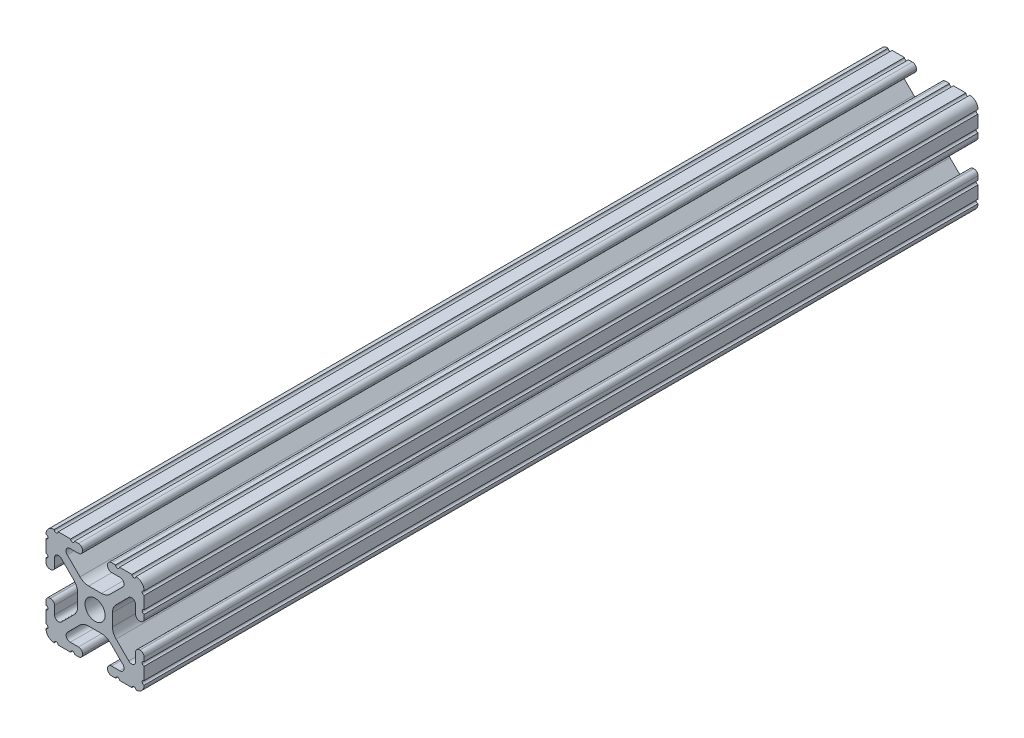
from build123d import *

# Parameters (mm, degrees)
SKETCH1_R           = 2.6035
BOSS_EXTRUDE1_DEPTH = 107.95


with BuildPart() as part:
    # Sketch1 → Boss-Extrude1 (new, symmetric)
    with BuildSketch(Plane.XY):
        with BuildLine():
            Line((-7.179650497, -8.645192506), (-3.952270251, -5.423690499))
            ThreePointArc((-3.952270251, -5.423690499), (-2.922936451, -4.736929036), (-1.709253557, -4.4958))
            Line((-1.709253557, -4.4958), (1.709253557, -4.4958))
            ThreePointArc((1.709253557, -4.4958), (2.922936451, -4.736929036), (3.952270251, -5.423690499))
            Line((3.952270251, -5.423690499), (7.179650497, -8.645192506))
            ThreePointArc((7.179650497, -8.645192506), (7.41473083, -9.822813117), (6.416408329, -10.4902))
            Line((6.416408329, -10.4902), (4.287512407, -10.4902))
            ThreePointArc((4.287512407, -10.4902), (3.54574862, -10.79744862), (3.2385, -11.539212407))
            Line((3.2385, -11.539212407), (3.2385, -11.650987593))
            ThreePointArc((3.2385, -11.650987593), (3.54574862, -12.39275138), (4.287512407, -12.7))
            Line((4.287512407, -12.7), (5.317126718, -12.7))
            ThreePointArc((5.317126718, -12.7), (5.825126718, -12.192), (6.333126718, -12.7))
            Line((6.333126718, -12.7), (9.550443118, -12.7))
            ThreePointArc((9.550443118, -12.7), (10.058366869, -12.192000006), (10.566443095, -12.699847501))
            ThreePointArc((10.566443095, -12.699847501), (12.082537762, -12.08250727), (12.699846982, -10.566399977))
            ThreePointArc((12.699846982, -10.566399977), (12.192000006, -10.058323491), (12.7, -9.5504))
            Line((12.7, -9.5504), (12.7, -6.3330836))
            ThreePointArc((12.7, -6.3330836), (12.192, -5.8250836), (12.7, -5.3170836))
            Line((12.7, -5.3170836), (12.7, -4.287469289))
            ThreePointArc((12.7, -4.287469289), (12.39275138, -3.545705502), (11.650987593, -3.238456882))
            Line((11.650987593, -3.238456882), (11.539212407, -3.238456882))
            ThreePointArc((11.539212407, -3.238456882), (10.79744862, -3.545705502), (10.4902, -4.287469289))
            Line((10.4902, -4.287469289), (10.4902, -6.402089023))
            ThreePointArc((10.4902, -6.402089023), (9.856505071, -7.351067942), (8.737131347, -7.129408934))
            Line((8.737131347, -7.129408934), (5.441005833, -3.840816462))
            ThreePointArc((5.441005833, -3.840816462), (4.750877967, -2.809883091), (4.5085, -1.593185507))
            Line((4.5085, -1.593185507), (4.5085, 1.593185507))
            ThreePointArc((4.5085, 1.593185507), (4.750877967, 2.809883091), (5.441005833, 3.840816462))
            Line((5.441005833, 3.840816462), (8.737131347, 7.129408934))
            ThreePointArc((8.737131347, 7.129408934), (9.856505071, 7.351067942), (10.4902, 6.402089023))
            Line((10.4902, 6.402089023), (10.4902, 4.287469289))
            ThreePointArc((10.4902, 4.287469289), (10.79744862, 3.545705502), (11.539212407, 3.238456882))
            Line((11.539212407, 3.238456882), (11.650987593, 3.238456882))
            ThreePointArc((11.650987593, 3.238456882), (12.39275138, 3.545705502), (12.7, 4.287469289))
            Line((12.7, 4.287469289), (12.7, 5.3170836))
            ThreePointArc((12.7, 5.3170836), (12.192, 5.8250836), (12.7, 6.3330836))
            Line((12.7, 6.3330836), (12.7, 9.5504))
            ThreePointArc((12.7, 9.5504), (12.192000006, 10.058323491), (12.699846982, 10.566399977))
            ThreePointArc((12.699846982, 10.566399977), (12.082537762, 12.08250727), (10.566443095, 12.699847501))
            ThreePointArc((10.566443095, 12.699847501), (10.058366869, 12.192000006), (9.550443118, 12.7))
            Line((9.550443118, 12.7), (6.333126718, 12.7))
            ThreePointArc((6.333126718, 12.7), (5.825126718, 12.192), (5.317126718, 12.7))
            Line((5.317126718, 12.7), (4.287512407, 12.7))
            ThreePointArc((4.287512407, 12.7), (3.54574862, 12.39275138), (3.2385, 11.650987593))
            Line((3.2385, 11.650987593), (3.2385, 11.539212407))
            ThreePointArc((3.2385, 11.539212407), (3.54574862, 10.79744862), (4.287512407, 10.4902))
            Line((4.287512407, 10.4902), (6.476788598, 10.4902))
            ThreePointArc((6.476788598, 10.4902), (7.432222385, 9.85140422), (7.207036008, 8.724370562))
            Line((7.207036008, 8.724370562), (3.898272566, 5.423169045))
            ThreePointArc((3.898272566, 5.423169045), (2.869120213, 4.736787962), (1.655778399, 4.4958))
            Line((1.655778399, 4.4958), (-1.655778399, 4.4958))
            ThreePointArc((-1.655778399, 4.4958), (-2.869120213, 4.736787962), (-3.898272566, 5.423169045))
            Line((-3.898272566, 5.423169045), (-7.207036008, 8.724370562))
            ThreePointArc((-7.207036008, 8.724370562), (-7.432222385, 9.85140422), (-6.476788598, 10.4902))
            Line((-6.476788598, 10.4902), (-4.287512407, 10.4902))
            ThreePointArc((-4.287512407, 10.4902), (-3.54574862, 10.79744862), (-3.2385, 11.539212407))
            Line((-3.2385, 11.539212407), (-3.2385, 11.650987593))
            ThreePointArc((-3.2385, 11.650987593), (-3.54574862, 12.39275138), (-4.287512407, 12.7))
            Line((-4.287512407, 12.7), (-5.317126718, 12.7))
            ThreePointArc((-5.317126718, 12.7), (-5.825126718, 12.192), (-6.333126718, 12.7))
            Line((-6.333126718, 12.7), (-9.550443118, 12.7))
            ThreePointArc((-9.550443118, 12.7), (-10.058366869, 12.192000006), (-10.566443095, 12.699847501))
            ThreePointArc((-10.566443095, 12.699847501), (-12.082537762, 12.08250727), (-12.699846982, 10.566399977))
            ThreePointArc((-12.699846982, 10.566399977), (-12.192000006, 10.058323491), (-12.7, 9.5504))
            Line((-12.7, 9.5504), (-12.7, 6.3330836))
            ThreePointArc((-12.7, 6.3330836), (-12.192, 5.8250836), (-12.7, 5.3170836))
            Line((-12.7, 5.3170836), (-12.7, 4.287469289))
            ThreePointArc((-12.7, 4.287469289), (-12.39275138, 3.545705502), (-11.650987593, 3.238456882))
            Line((-11.650987593, 3.238456882), (-11.539212407, 3.238456882))
            ThreePointArc((-11.539212407, 3.238456882), (-10.79744862, 3.545705502), (-10.4902, 4.287469289))
            Line((-10.4902, 4.287469289), (-10.4902, 6.402089023))
            ThreePointArc((-10.4902, 6.402089023), (-9.856505071, 7.351067942), (-8.737131347, 7.129408934))
            Line((-8.737131347, 7.129408934), (-5.441005833, 3.840816462))
            ThreePointArc((-5.441005833, 3.840816462), (-4.750877967, 2.809883091), (-4.5085, 1.593185507))
            Line((-4.5085, 1.593185507), (-4.5085, -1.593185507))
            ThreePointArc((-4.5085, -1.593185507), (-4.750877967, -2.809883091), (-5.441005833, -3.840816462))
            Line((-5.441005833, -3.840816462), (-8.737131347, -7.129408934))
            ThreePointArc((-8.737131347, -7.129408934), (-9.856505071, -7.351067942), (-10.4902, -6.402089023))
            Line((-10.4902, -6.402089023), (-10.4902, -4.287469289))
            ThreePointArc((-10.4902, -4.287469289), (-10.79744862, -3.545705502), (-11.539212407, -3.238456882))
            Line((-11.539212407, -3.238456882), (-11.650987593, -3.238456882))
            ThreePointArc((-11.650987593, -3.238456882), (-12.39275138, -3.545705502), (-12.7, -4.287469289))
            Line((-12.7, -4.287469289), (-12.7, -5.3170836))
            ThreePointArc((-12.7, -5.3170836), (-12.192, -5.8250836), (-12.7, -6.3330836))
            Line((-12.7, -6.3330836), (-12.7, -9.5504))
            ThreePointArc((-12.7, -9.5504), (-12.192000006, -10.058323491), (-12.699846982, -10.566399977))
            ThreePointArc((-12.699846982, -10.566399977), (-12.082537762, -12.08250727), (-10.566443095, -12.699847501))
            ThreePointArc((-10.566443095, -12.699847501), (-10.058366869, -12.192000006), (-9.550443118, -12.7))
            Line((-9.550443118, -12.7), (-6.333126718, -12.7))
            ThreePointArc((-6.333126718, -12.7), (-5.825126718, -12.192), (-5.317126718, -12.7))
            Line((-5.317126718, -12.7), (-4.287512407, -12.7))
            ThreePointArc((-4.287512407, -12.7), (-3.54574862, -12.39275138), (-3.2385, -11.650987593))
            Line((-3.2385, -11.650987593), (-3.2385, -11.539212407))
            ThreePointArc((-3.2385, -11.539212407), (-3.54574862, -10.79744862), (-4.287512407, -10.4902))
            Line((-4.287512407, -10.4902), (-6.416408329, -10.4902))
            ThreePointArc((-6.416408329, -10.4902), (-7.41473083, -9.822813117), (-7.179650497, -8.645192506))
        make_face()
        Circle(SKETCH1_R, mode=Mode.SUBTRACT)
    extrude(amount=BOSS_EXTRUDE1_DEPTH, both=True)


solid = part.part
